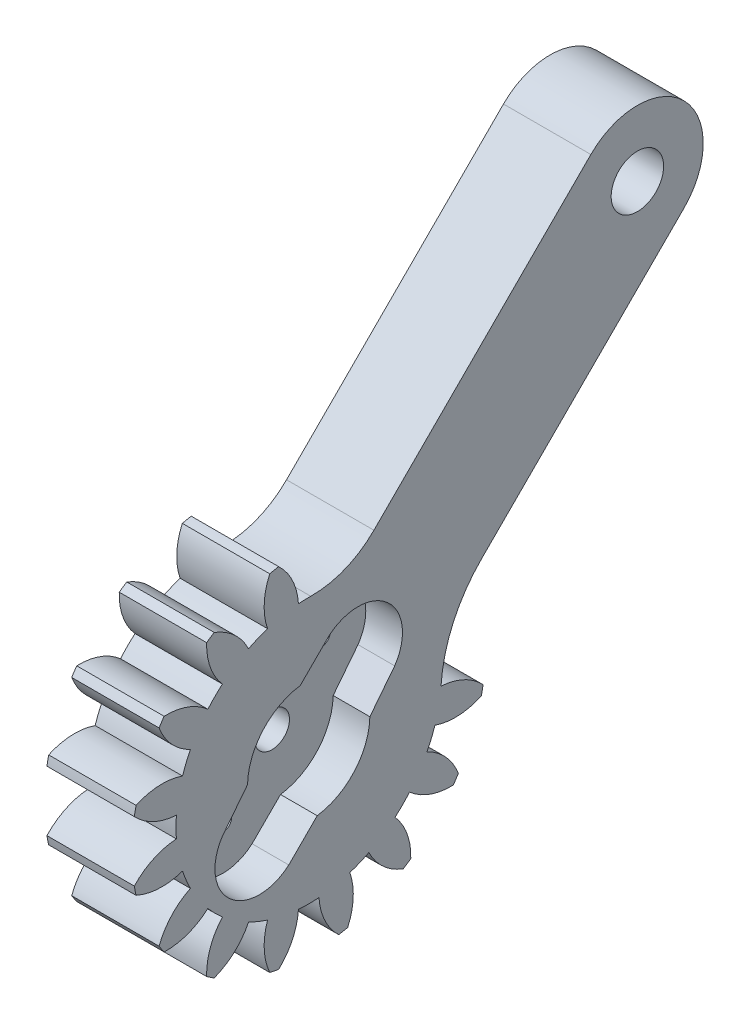
from build123d import *

# Parameters (mm, degrees)
BASPROSKE_W             = 5
BASPROSKE_H             = 10.125
TOOTHCUT_DEPTH          = 16.166781135
TEETHCUTS_COUNT         = 13
TEETHCUTS_ANGLE         = 270
BORSKE_R                = 2.5
BORE_DEPTH              = 50.0000508
ENL_V_START             = -10
ENL_V_MAT_EXTRU_1_DEPTH = 10
ESQUISSE2_R             = 1.5
BOSS_EXTRU_1_DEPTH      = 5
BOSS_EXTRU_2_START      = -1
ESQUISSE3_R             = 2.5
BOSS_EXTRU_2_DEPTH      = 4
ESQUISSE4_R             = 1
ENL_V_MAT_EXTRU_2_DEPTH = 10
CONG_1_R                = 5
CONG_2_R                = 8
ENL_V_MAT_EXTRU_4_DEPTH = 2.1
ESQUISSE8_R             = 0.515
ENL_V_MAT_EXTRU_5_DEPTH = 33.049570744


with BuildPart() as part:
    # BasProSke → Base-Revolve (revolve)
    with BuildSketch(Plane(origin=(0, 0, 0), x_dir=(1, 0, 0), z_dir=(0, 1, 0)), mode=Mode.PRIVATE) as base_revolve_sk:
        with Locations((2.5, 5.0625)):
            Rectangle(BASPROSKE_W, BASPROSKE_H)
    revolve(base_revolve_sk.sketch.rotate(Axis((-10, 0, 0), (1, 0, 0)), 180), axis=Axis((-10, 0, 0), (1, 0, 0)))

    # TooCutSke → ToothCut (cut, through all)
    with BuildSketch(Plane(origin=(0, 0, 0), x_dir=(0, 0, -1), z_dir=(1, 0, 0))):
        with BuildLine():
            ThreePointArc((0.588166249, 7.56993481), (0, 7.59275), (-0.588166249, 7.56993481))
            ThreePointArc((-0.588166249, 7.56993481), (-0.930156891, 8.896709021), (-1.743114395, 9.999608611))
            ThreePointArc((-1.743114395, 9.999608611), (0, 10.1504), (1.743114395, 9.999608611))
            ThreePointArc((1.743114395, 9.999608611), (0.930156891, 8.896709021), (0.588166249, 7.56993481))
        make_face()
    toothcut = extrude(amount=TOOTHCUT_DEPTH, mode=Mode.SUBTRACT)

    # TeethCuts: ToothCut ×13 about axis
    teethcuts_axis = Axis((-10, 0, 0), (1, 0, 0))
    for i in range(1, TEETHCUTS_COUNT):
        add(toothcut.rotate(teethcuts_axis, i * TEETHCUTS_ANGLE / (TEETHCUTS_COUNT - 1)), mode=Mode.SUBTRACT)

    # BorSke → Bore (cut, symmetric)
    with BuildSketch(Plane(origin=(0, 0, 0), x_dir=(0, 0, -1), z_dir=(1, 0, 0))):
        with Locations(Location((0, 0, 0), (0, 0, 180))):
            Circle(BORSKE_R)
    extrude(amount=BORE_DEPTH, both=True, mode=Mode.SUBTRACT)

    # Esquisse1 → Enlèv. mat.-Extru.1 (cut)
    with BuildSketch(Plane(origin=(5, 0, 0), x_dir=(0, 0, -1), z_dir=(1, 0, 0)).offset(ENL_V_START)):
        with BuildLine():
            ThreePointArc((7.56993481, 0.588166249), (5.368885013, 5.368885013), (0.588166249, 7.56993481))
            ThreePointArc((0.588166249, 7.56993481), (0.923336805, 8.882279141), (1.719727125, 9.977883724))
            ThreePointArc((1.719727125, 9.977883724), (7.15945616, 7.15945616), (9.977883724, 1.719727125))
            ThreePointArc((9.977883724, 1.719727125), (8.882279141, 0.923336805), (7.56993481, 0.588166249))
        make_face()
    extrude(amount=ENL_V_MAT_EXTRU_1_DEPTH, mode=Mode.SUBTRACT)

    # Esquisse2 → Boss.-Extru.1 (add, through all)
    with BuildSketch(Plane(origin=(5, 0, 0), x_dir=(0, 0, -1), z_dir=(1, 0, 0))):
        with BuildLine():
            Line((16.142135624, 21.46674159), (2, 7.324605966))
            ThreePointArc((2, 7.324605966), (5.368885013, 5.368885013), (7.324605966, 2))
            Line((7.324605966, 2), (21.46674159, 16.142135624))
            ThreePointArc((21.46674159, 16.142135624), (21.46674159, 21.46674159), (16.142135624, 21.46674159))
        make_face()
        with Locations((18.804438607, 18.804438607)):
            Circle(ESQUISSE2_R, mode=Mode.SUBTRACT)
    extrude(amount=-BOSS_EXTRU_1_DEPTH)

    # Esquisse3 → Boss.-Extru.2 (add, through all)
    with BuildSketch(Plane(origin=(5, 0, 0), x_dir=(0, 0, -1), z_dir=(1, 0, 0)).offset(BOSS_EXTRU_2_START)):
        with Locations(Location((0, 0, 0), (0, 0, 180))):
            Circle(ESQUISSE3_R)
    extrude(amount=-BOSS_EXTRU_2_DEPTH)

    # Esquisse4 → Enlèv. mat.-Extru.2 (cut)
    with BuildSketch(Plane(origin=(4, 0, 0), x_dir=(0, 0, -1), z_dir=(1, 0, 0))):
        Circle(ESQUISSE4_R)
    extrude(amount=-ENL_V_MAT_EXTRU_2_DEPTH, mode=Mode.SUBTRACT)

    # Congé1
    cong_1_edges = [part.edges().sort_by_distance(p)[0] for p in [
        (2.5, 7.324605966, -2),
    ]]
    fillet(cong_1_edges, radius=CONG_1_R)

    # Congé2
    cong_2_edges = [part.edges().sort_by_distance(p)[0] for p in [
        (2.5, 2, -7.324605966),
    ]]
    fillet(cong_2_edges, radius=CONG_2_R)

    # Esquisse6 → Enlèv. mat.-Extru.4 (cut)
    with BuildSketch(Plane(origin=(5, 0, 0), x_dir=(0, 0, -1), z_dir=(1, 0, 0))):
        with BuildLine():
            Line((-0.486746212, 3.465988766), (1.140136775, 5.092871753))
            ThreePointArc((1.140136775, 5.092871753), (4.507727263, 5.08472958), (4.91940393, 1.742386942))
            Line((4.91940393, 1.742386942), (3.499344691, -0.067725445))
            ThreePointArc((3.499344691, -0.067725445), (2.619022446, -2.321792719), (0.486746212, -3.465988766))
            Line((0.486746212, -3.465988766), (-1.140072016, -5.092806994))
            ThreePointArc((-1.140072016, -5.092806994), (-4.507662796, -5.08478673), (-4.919460458, -1.742458998))
            Line((-4.919460458, -1.742458998), (-3.499344691, 0.067725445))
            ThreePointArc((-3.499344691, 0.067725445), (-2.619022446, 2.321792719), (-0.486746212, 3.465988766))
        make_face()
    extrude(amount=-ENL_V_MAT_EXTRU_4_DEPTH, mode=Mode.SUBTRACT)

    # Esquisse8 → Enlèv. mat.-Extru.5 (cut, through all)
    with BuildSketch(Plane(origin=(2.9, 0, 0), x_dir=(0, 0, -1), z_dir=(1, 0, 0))):
        with Locations((-2.81931973, -3.180241541)):
            Circle(ESQUISSE8_R)
        with Locations((2.81931973, 3.180241541)):
            Circle(ESQUISSE8_R)
    extrude(amount=-ENL_V_MAT_EXTRU_5_DEPTH, mode=Mode.SUBTRACT)


solid = part.part
